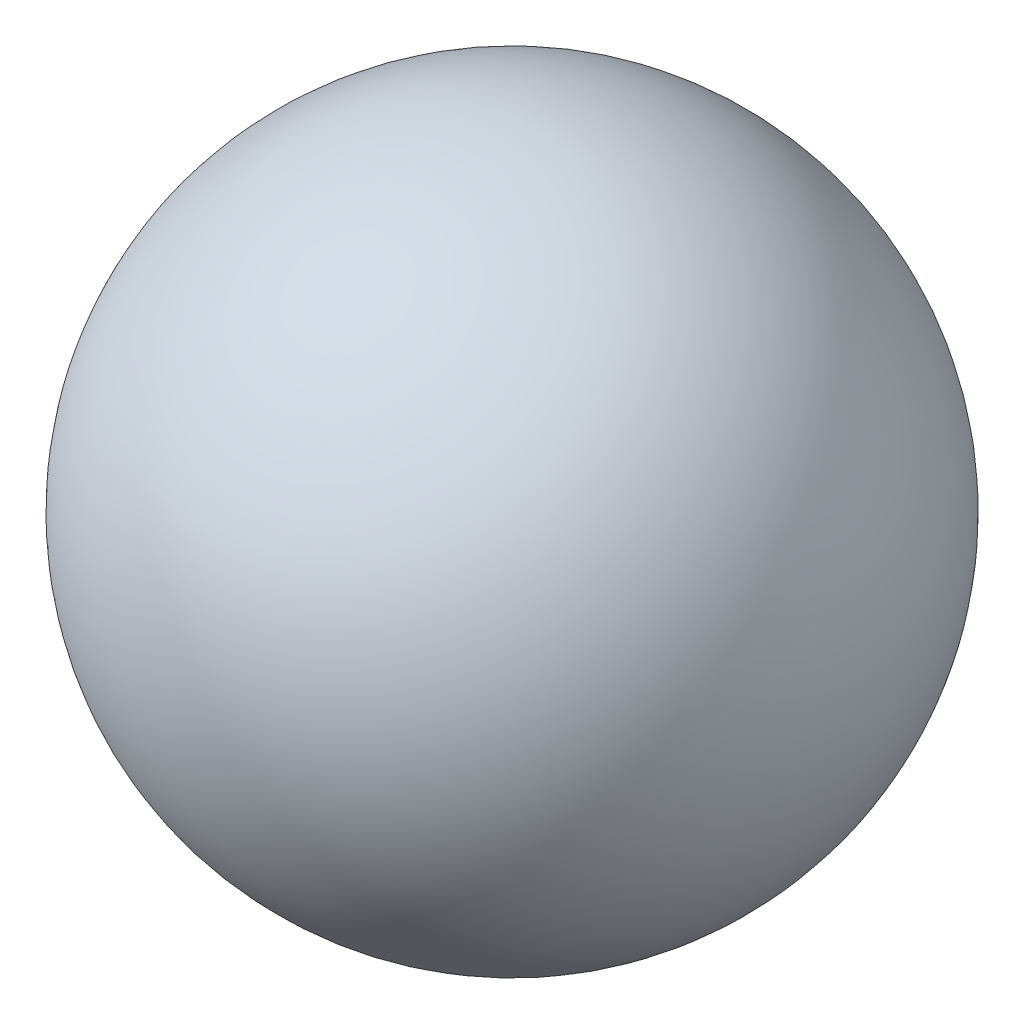
from build123d import *


with BuildPart() as part:
    # Sketch1 → Revolve1 (revolve)
    with BuildSketch(Plane.XY):
        with BuildLine():
            Line((-38.1, 0), (38.1, 0))
            ThreePointArc((38.1, 0), (0, 38.1), (-38.1, 0))
        make_face()
    revolve(axis=Axis((0, 0, 0), (-1, 0, 0)))


solid = part.part
